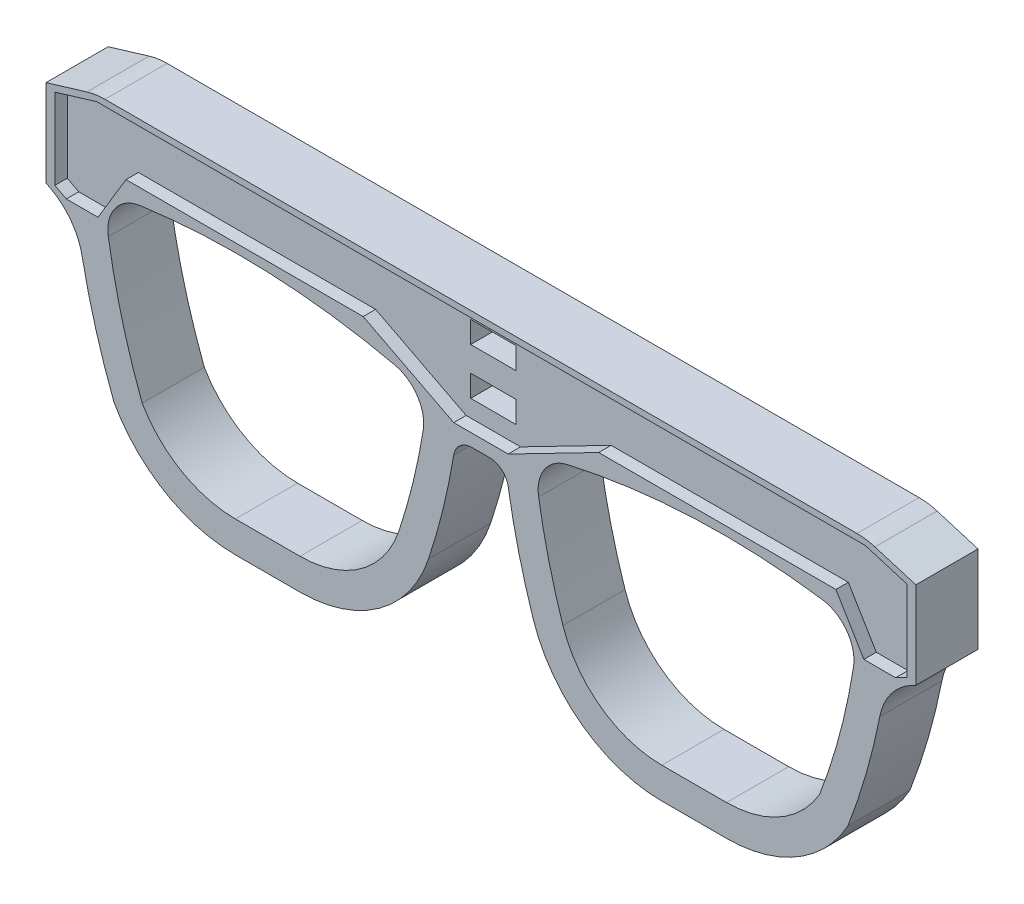
from build123d import *

# Parameters (mm, degrees)
BOSS_EXTRUDE1_DEPTH  = 10
CUT_EXTRUDE1_DEPTH   = 79.460180984
FILLET1_R            = 6
FILLET4_R            = 3
FILLET5_R            = 10
FILLET1_OF_MIRROR2_R = 6
FILLET4_OF_MIRROR2_R = 3
FILLET5_OF_MIRROR2_R = 10
CUT_EXTRUDE2_DEPTH   = 2
SKETCH4_W            = 7.3
SKETCH4_H            = 3.5
CUT_EXTRUDE3_DEPTH   = 79.230429006


with BuildPart() as part:
    # Sketch1 → Boss-Extrude1 (new body)
    with BuildSketch(Plane.XY):
        with BuildLine():
            Line((-70, 16.58258549), (-70, 2.58258549))
            Line((-70, 2.58258549), (-65, -0.035347018))
            ThreePointArc((-65, -0.035347018), (-62.639321295, -11.428715409), (-59.057390955, -22.499009997))
            ThreePointArc((-59.057390955, -22.499009997), (-50.858075368, -30.911196539), (-39.524366721, -34))
            Line((-39.524366721, -34), (-29.119439011, -34))
            ThreePointArc((-29.119439011, -34), (-16.364659062, -29.873537236), (-8.443933007, -19.058075838))
            ThreePointArc((-8.443933007, -19.058075838), (-5.792248942, -9.629238804), (-4, 0))
            Line((-4, 0), (0, 0))
            Line((0, 0), (0, 19))
            Line((0, 19), (-62, 19))
            Line((-62, 19), (-70, 16.58258549))
        make_face()
    boss_extrude1 = extrude(amount=BOSS_EXTRUDE1_DEPTH)

    # Sketch2 → Cut-Extrude1 (cut, through all)
    with BuildSketch(Plane.XY.offset(10)):
        with BuildLine():
            Line((-39.524366721, -29), (-29.119439011, -29))
            ThreePointArc((-29.119439011, -29), (-19.293350153, -25.821035725), (-13.191343035, -17.488968441))
            ThreePointArc((-13.191343035, -17.488968441), (-10.661621804, -8.493805879), (-8.951806424, 0.692541077))
            ThreePointArc((-8.951806424, 0.692541077), (-8.83111114, 2.375291538), (-8.93749946, 4.05900707))
            ThreePointArc((-8.93749946, 4.05900707), (-33.987475013, 7.999161751), (-59.288689209, 6.303681198))
            ThreePointArc((-59.288689209, 6.303681198), (-60.075532666, 3.563074376), (-60.056140486, 0.711816353))
            ThreePointArc((-60.056140486, 0.711816353), (-57.852345066, -9.972645379), (-54.521869403, -20.361214511))
            ThreePointArc((-54.521869403, -20.361214511), (-48.178176596, -26.685865227), (-39.524366721, -29))
        make_face()
    cut_extrude1 = extrude(amount=-CUT_EXTRUDE1_DEPTH, mode=Mode.SUBTRACT)

    # Fillet1
    fillet1_edges = [part.edges().sort_by_distance(p)[0] for p in [
        (-8.93749946, 4.05900707, 5),
        (-59.288689209, 6.303681198, 5),
    ]]
    fillet(fillet1_edges, radius=FILLET1_R)

    # Fillet4
    fillet4_edges = [part.edges().sort_by_distance(p)[0] for p in [
        (-4, 0, 5),
    ]]
    fillet(fillet4_edges, radius=FILLET4_R)

    # Fillet5
    fillet5_edges = [part.edges().sort_by_distance(p)[0] for p in [
        (-65, -0.035347018, 5),
        (-62, 19, 5),
    ]]
    fillet(fillet5_edges, radius=FILLET5_R)

    # Mirror2: Boss-Extrude1, Cut-Extrude1 across plane
    add(boss_extrude1.mirror(Plane(origin=(0, 19, 10), x_dir=(0, 0, 1), z_dir=(1, 0, 0))))
    add(cut_extrude1.mirror(Plane(origin=(0, 19, 10), x_dir=(0, 0, 1), z_dir=(1, 0, 0))), mode=Mode.SUBTRACT)

    # Fillet1 of Mirror2
    fillet1_of_mirror2_edges = [part.edges().sort_by_distance(p)[0] for p in [
        (8.93749946, 4.05900707, 5),
        (59.288689209, 6.303681198, 5),
    ]]
    fillet(fillet1_of_mirror2_edges, radius=FILLET1_OF_MIRROR2_R)

    # Fillet4 of Mirror2
    fillet4_of_mirror2_edges = [part.edges().sort_by_distance(p)[0] for p in [
        (4, 0, 5),
    ]]
    fillet(fillet4_of_mirror2_edges, radius=FILLET4_OF_MIRROR2_R)

    # Fillet5 of Mirror2
    fillet5_of_mirror2_edges = [part.edges().sort_by_distance(p)[0] for p in [
        (65, -0.035347018, 5),
        (62, 19, 5),
    ]]
    fillet(fillet5_of_mirror2_edges, radius=FILLET5_OF_MIRROR2_R)

    # Sketch3 → Cut-Extrude2 (cut)
    with BuildSketch(Plane.XY.offset(10)):
        Polygon((-68.579000582, 15.967320332), (-61.852211578, 18), (61.852211578, 18), (68.579000582, 15.967320332), (68.579000582, 2.967348727), (66.731457293, 2), (61.632252323, 2), (57.126911514, 9.5), (18.95111491, 9.5), (4.382114171, 2), (-4.382114171, 2), (-18.95111491, 9.5), (-57.126911514, 9.5), (-61.632252323, 2), (-66.731457293, 2), (-68.579000582, 2.967348727), align=None)
    extrude(amount=-CUT_EXTRUDE2_DEPTH, mode=Mode.SUBTRACT)

    # Sketch4 → Cut-Extrude3 (cut, through all)
    with BuildSketch(Plane.XY.offset(8)):
        with Locations((0, 14)):
            Rectangle(SKETCH4_W, SKETCH4_H)
        with Locations((0, 6.5)):
            Rectangle(SKETCH4_W, SKETCH4_H)
    extrude(amount=-CUT_EXTRUDE3_DEPTH, mode=Mode.SUBTRACT)


solid = part.part
